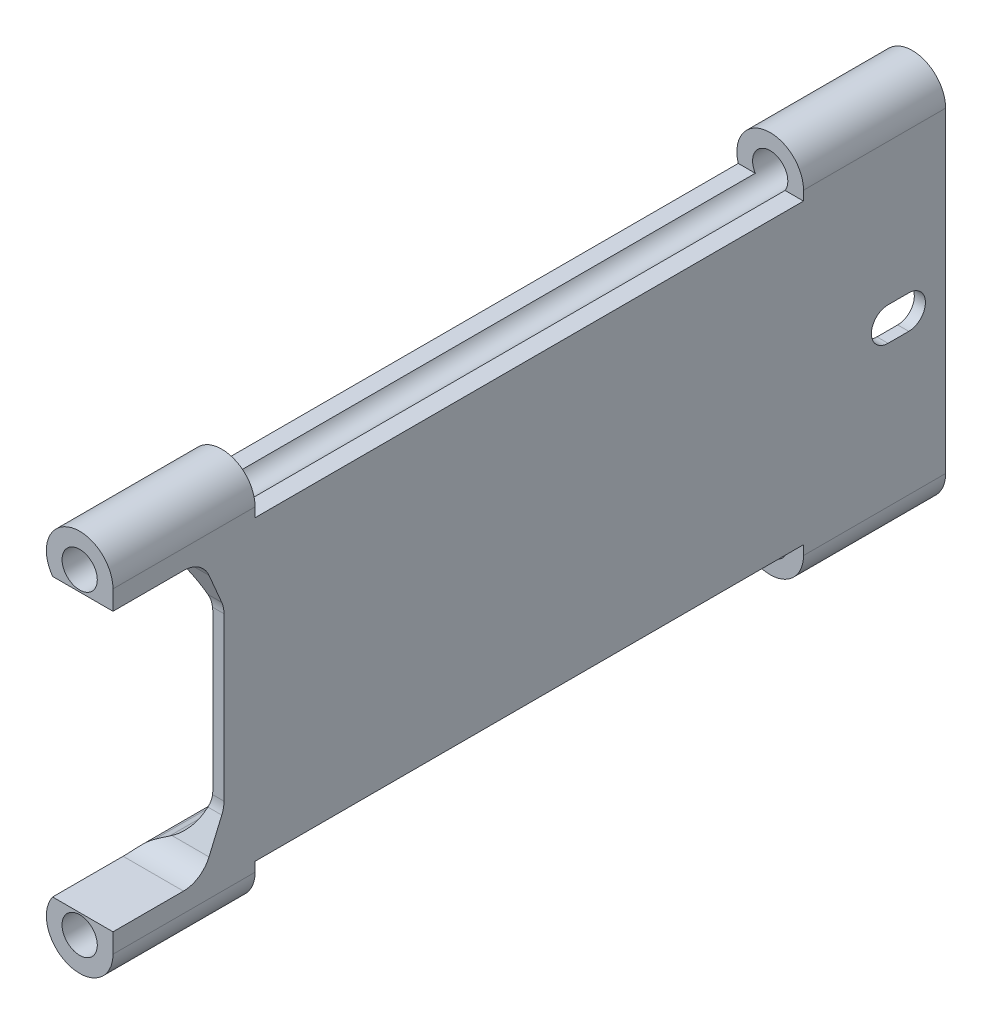
from build123d import *

# Parameters (mm, degrees)
CROQUIS1_R              = 3.175
SALIENTE_EXTRUIR1_DEPTH = 150
REDONDEO1_R             = 10
CORTAR_EXTRUIR1_DEPTH   = 155.383451186
REDONDEO2_R             = 5
CROQUIS3_W              = 98.791812306
CROQUIS3_H              = 18.145434914
CORTAR_EXTRUIR2_DEPTH   = 155.383451313
CORTAR_EXTRUIR3_DEPTH   = 155.240883163


with BuildPart() as part:
    # Croquis1 → Saliente-Extruir1 (new body)
    with BuildSketch(Plane.XY):
        with BuildLine():
            Line((-2, 19.285827964), (-8.98691391, 23.296314259))
            ThreePointArc((-8.98691391, 23.296314259), (-9.006535925, 33.69237342), (0, 28.5))
            Line((0, 28.5), (0, -28.5))
            ThreePointArc((0, -28.5), (-9.006535925, -33.69237342), (-8.98691391, -23.296314259))
            Line((-8.98691391, -23.296314259), (-2, -19.285827964))
            Line((-2, -19.285827964), (-2, 19.285827964))
        make_face()
        with Locations((-6, 28.5)):
            Circle(CROQUIS1_R, mode=Mode.SUBTRACT)
        with Locations(Location((-6, -28.5, 0), (0, 0, 180))):
            Circle(CROQUIS1_R, mode=Mode.SUBTRACT)
    extrude(amount=-SALIENTE_EXTRUIR1_DEPTH)

    # Redondeo1
    redondeo1_edges = [part.edges().sort_by_distance(p)[0] for p in [
        (-2, -19.285827964, -75),
        (-2, 19.285827964, -75),
    ]]
    fillet(redondeo1_edges, radius=REDONDEO1_R)

    # Croquis2 → Cortar-Extruir1 (cut, through all)
    with BuildSketch(Plane(origin=(0, 0, 0), x_dir=(0, 0, -1), z_dir=(1, 0, 0))):
        Polygon((16, 25), (20, 15.646846929), (20, -15.646846929), (16, -25), (-29.873538988, -25), (-29.873538988, 25), align=None)
    extrude(amount=-CORTAR_EXTRUIR1_DEPTH, mode=Mode.SUBTRACT)

    # Redondeo2
    redondeo2_edges = [part.edges().sort_by_distance(p)[0] for p in [
        (-1.117074127, 15.646846929, -20),
        (-1.117074127, -15.646846929, -20),
        (-5.436698586, -25, -16),
        (-5.436698586, 25, -16),
    ]]
    fillet(redondeo2_edges, radius=REDONDEO2_R)

    # Croquis3 → Cortar-Extruir2 (cut, through all)
    with BuildSketch(Plane(origin=(0, 0, 0), x_dir=(0, 0, -1), z_dir=(1, 0, 0))):
        with Locations((75, 35.875128035)):
            Rectangle(CROQUIS3_W, CROQUIS3_H)
        with Locations((75, -35.875128035)):
            Rectangle(CROQUIS3_W, CROQUIS3_H)
    extrude(amount=-CORTAR_EXTRUIR2_DEPTH, mode=Mode.SUBTRACT)

    # Croquis4 → Cortar-Extruir3 (cut, through all)
    with BuildSketch(Plane.ZY.offset(2)):
        with BuildLine():
            Line((-143.359821197, 3), (-139.627206237, 3))
            ThreePointArc((-139.627206237, 3), (-136.627206237, 0), (-139.627206237, -3))
            Line((-139.627206237, -3), (-143.359821197, -3))
            ThreePointArc((-143.359821197, -3), (-146.359821197, 0), (-143.359821197, 3))
        make_face()
    extrude(amount=-CORTAR_EXTRUIR3_DEPTH, mode=Mode.SUBTRACT)


solid = part.part
